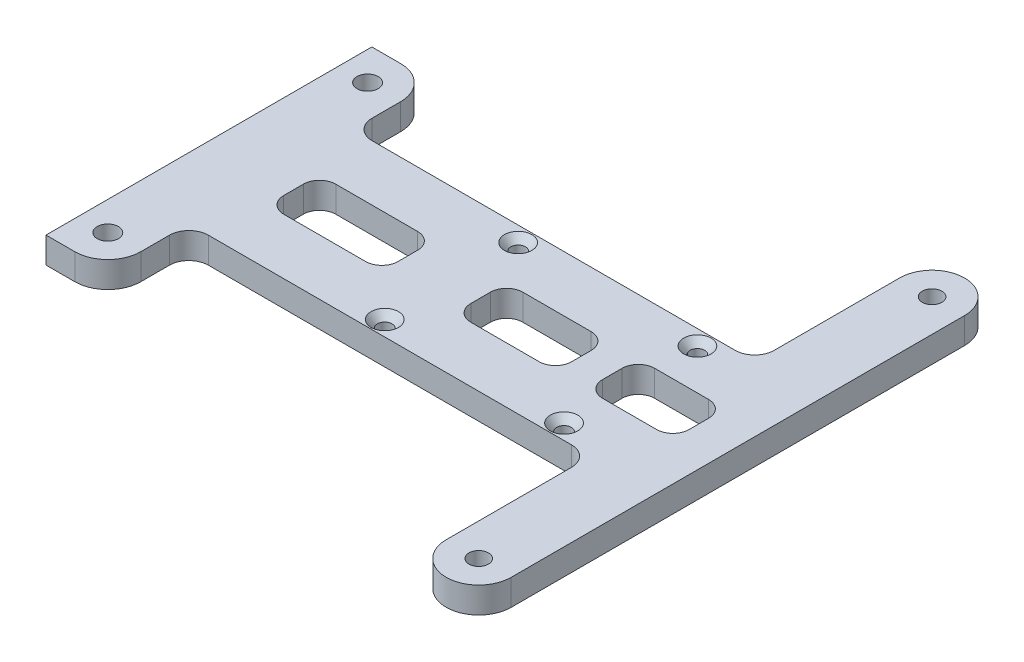
from build123d import *

# Parameters (mm, degrees)
CROQUIS1_R                                           = 3
CROQUIS1_R_2                                         = 3.25
CROQUIS1_W                                           = 26.6
CROQUIS1_H                                           = 16
CROQUIS1_W_2                                         = 31
CROQUIS1_W_3                                         = 35.15
SALIENTE_EXTRUIR1_DEPTH                              = 8
REDONDEO3_R                                          = 5
AVELLANADO_PARA_TORNILLO_CON_CABEZA_OVAL_D           = 4.4958
AVELLANADO_PARA_TORNILLO_CON_CABEZA_OVAL_CSINK_D     = 8.4328
AVELLANADO_PARA_TORNILLO_CON_CABEZA_OVAL_CSINK_ANGLE = 82


with BuildPart() as part:
    # Croquis1 → Saliente-Extruir1 (new body)
    with BuildSketch(Plane(origin=(0, 0, 0), x_dir=(1, 0, 0), z_dir=(0, 1, 0))):
        with BuildLine():
            Line((0, -50.075), (0, 50.075))
            Line((0, 50.075), (8.85, 50.075))
            ThreePointArc((8.85, 50.075), (16.027133829, 47.102133829), (19, 39.925))
            Line((19, 39.925), (19, 31.15))
            ThreePointArc((19, 31.15), (20.757359313, 26.907359313), (25, 25.15))
            Line((25, 25.15), (136.6, 25.15))
            ThreePointArc((136.6, 25.15), (140.842640687, 26.907359313), (142.6, 31.15))
            Line((142.6, 31.15), (142.6, 69.675))
            ThreePointArc((142.6, 69.675), (152.6, 79.675), (162.6, 69.675))
            Line((162.6, 69.675), (162.6, -69.675))
            ThreePointArc((162.6, -69.675), (152.6, -79.675), (142.6, -69.675))
            Line((142.6, -69.675), (142.6, -31.15))
            ThreePointArc((142.6, -31.15), (140.842640687, -26.907359313), (136.6, -25.15))
            Line((136.6, -25.15), (25, -25.15))
            ThreePointArc((25, -25.15), (20.757359313, -26.907359313), (19, -31.15))
            Line((19, -31.15), (19, -39.925))
            ThreePointArc((19, -39.925), (16.027133829, -47.102133829), (8.85, -50.075))
            Line((8.85, -50.075), (0, -50.075))
        make_face()
        with Locations(Location((152.6, 69.675, 0), (0, 0, 270))):
            Circle(CROQUIS1_R, mode=Mode.SUBTRACT)
        with Locations(Location((152.6, -69.675, 0), (0, 0, 270))):
            Circle(CROQUIS1_R, mode=Mode.SUBTRACT)
        with Locations(Location((8.85, 39.925, 0), (0, 0, 270))):
            Circle(CROQUIS1_R_2, mode=Mode.SUBTRACT)
        with Locations(Location((8.85, -39.925, 0), (0, 0, 90))):
            Circle(CROQUIS1_R_2, mode=Mode.SUBTRACT)
        with Locations((137.3, 0)):
            Rectangle(CROQUIS1_W, CROQUIS1_H, mode=Mode.SUBTRACT)
        with Locations((99, 0)):
            Rectangle(CROQUIS1_W_2, CROQUIS1_H, mode=Mode.SUBTRACT)
        with Locations((43.575, 0)):
            Rectangle(CROQUIS1_W_3, CROQUIS1_H, mode=Mode.SUBTRACT)
    extrude(amount=SALIENTE_EXTRUIR1_DEPTH)

    # Redondeo3
    redondeo3_edges = [part.edges().sort_by_distance(p)[0] for p in [
        (83.5, 4, -8),
        (83.5, 4, 8),
        (114.5, 4, 8),
        (114.5, 4, -8),
        (124, 4, -8),
        (124, 4, 8),
        (150.6, 4, 8),
        (150.6, 4, -8),
        (26, 4, -8),
        (26, 4, 8),
        (61.15, 4, 8),
        (61.15, 4, -8),
    ]]
    fillet(redondeo3_edges, radius=REDONDEO3_R)

    # Avellanado para tornillo con cabeza ovalada de #81 (through all)
    with Locations(Plane(origin=(0, 8, 0), x_dir=(1, 0, 0), z_dir=(0, 1, 0))):
        with Locations((74.55, 20.5), (129.65, 20.5), (74.55, -20.5), (129.65, -20.5)):
            CounterSinkHole(AVELLANADO_PARA_TORNILLO_CON_CABEZA_OVAL_D / 2, AVELLANADO_PARA_TORNILLO_CON_CABEZA_OVAL_CSINK_D / 2, counter_sink_angle=AVELLANADO_PARA_TORNILLO_CON_CABEZA_OVAL_CSINK_ANGLE)


solid = part.part
